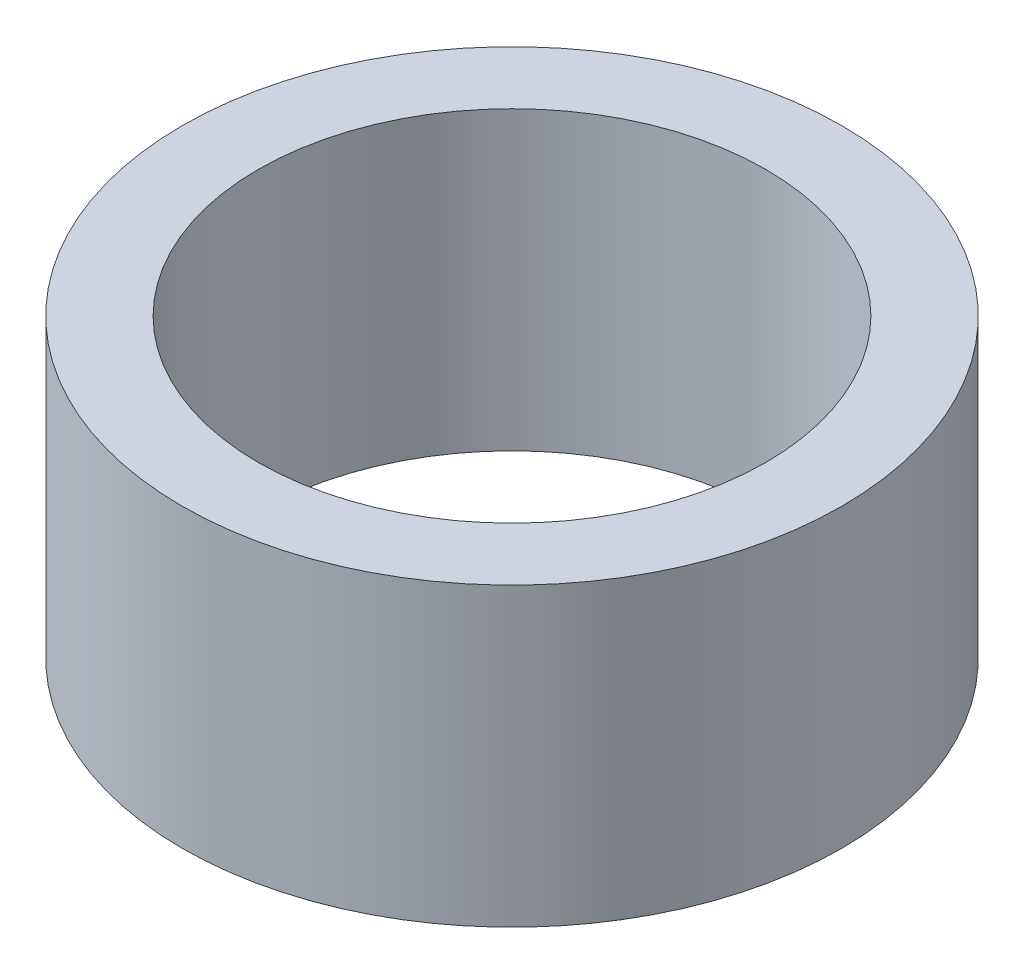
from build123d import *

# Parameters (mm, degrees)
SKETCH1_R           = 9.525
SKETCH1_R_2         = 7.332348419
BOSS_EXTRUDE1_DEPTH = 8.5598


with BuildPart() as part:
    # Sketch1 → Boss-Extrude1 (new body)
    with BuildSketch(Plane(origin=(0, 0, 0), x_dir=(1, 0, 0), z_dir=(0, 1, 0))):
        with Locations(Location((0, 0, 0), (0, 0, 270))):
            Circle(SKETCH1_R)
        with Locations(Location((0, 0, 0), (0, 0, 270))):
            Circle(SKETCH1_R_2, mode=Mode.SUBTRACT)
    extrude(amount=BOSS_EXTRUDE1_DEPTH)


solid = part.part
